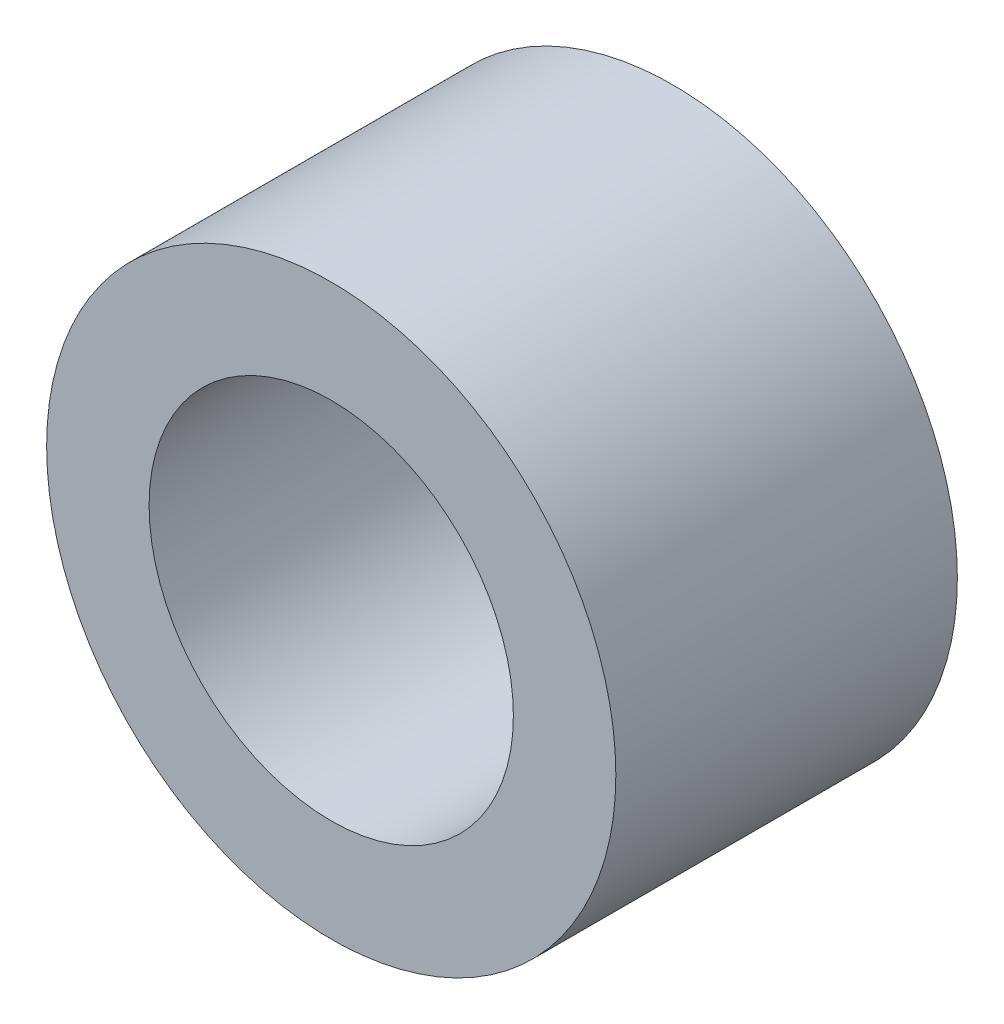
from build123d import *

# Parameters (mm, degrees)
SKETCH_1_R      = 2.5
SKETCH_1_R_2    = 1.6
EXTRUDE_1_DEPTH = 3


with BuildPart() as part:
    # Эскиз1 → Бобышка-Вытянуть1 (new body)
    with BuildSketch(Plane.XY):
        Circle(SKETCH_1_R)
        Circle(SKETCH_1_R_2, mode=Mode.SUBTRACT)
    extrude(amount=EXTRUDE_1_DEPTH)


solid = part.part
